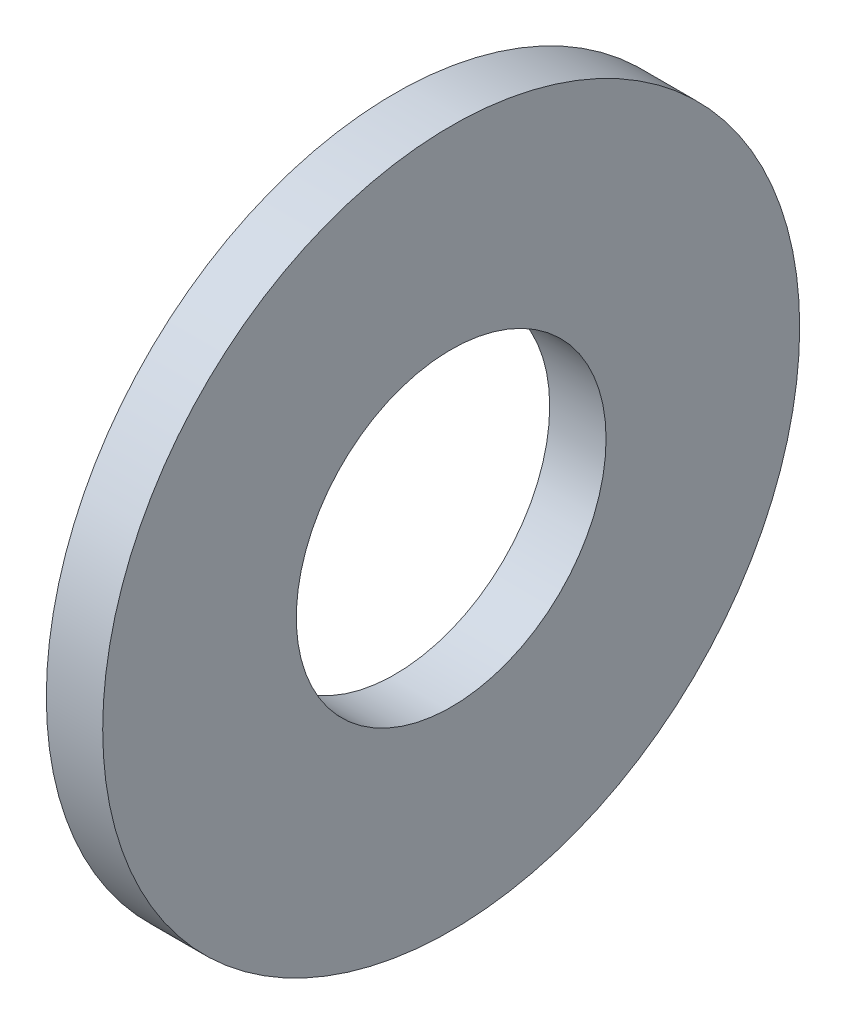
from build123d import *

# Parameters (mm, degrees)
SKETCH1_R           = 14.2875
SKETCH1_R_2         = 6.35
BOSS_EXTRUDE1_DEPTH = 2.3114


with BuildPart() as part:
    # Sketch1 → Boss-Extrude1 (new body)
    with BuildSketch(Plane(origin=(0, 0, 0), x_dir=(0, 0, -1), z_dir=(1, 0, 0))):
        Circle(SKETCH1_R)
        Circle(SKETCH1_R_2, mode=Mode.SUBTRACT)
    extrude(amount=BOSS_EXTRUDE1_DEPTH)


solid = part.part
